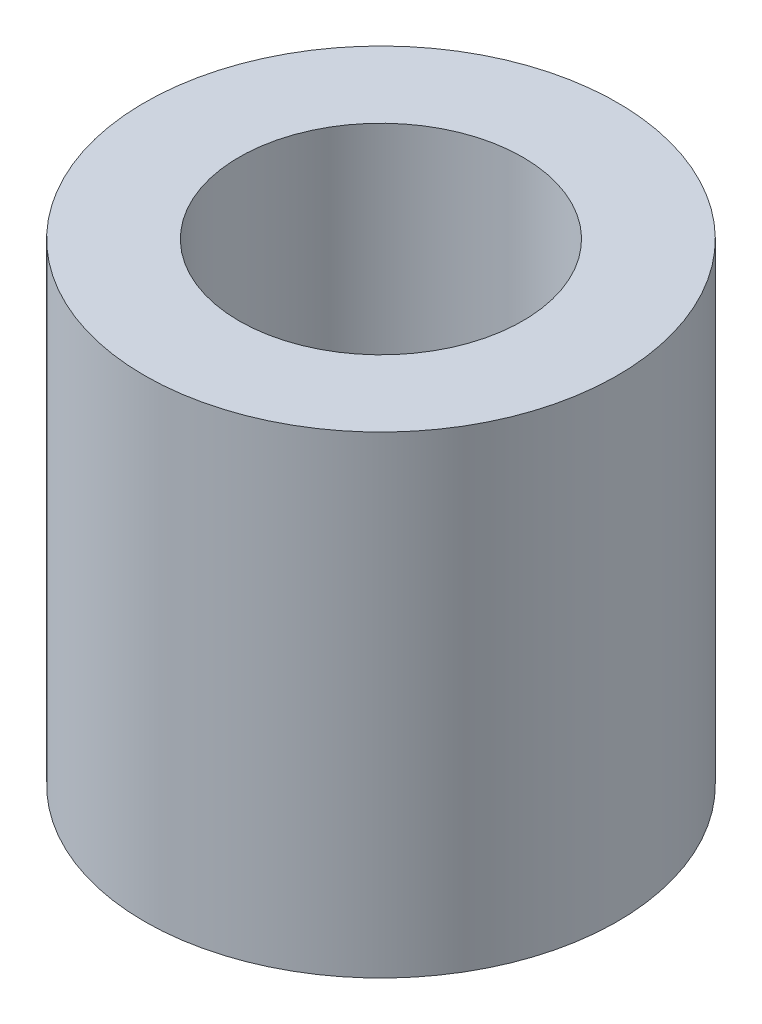
from build123d import *

# Parameters (mm, degrees)
SKETCH_1_R      = 5
SKETCH_1_R_2    = 3
EXTRUDE_1_DEPTH = 10


with BuildPart() as part:
    # 草图1 → 凸台-拉伸1 (new body)
    with BuildSketch(Plane(origin=(0, 0, 0), x_dir=(1, 0, 0), z_dir=(0, 1, 0))):
        with Locations(Location((0, 0, 0), (0, 0, 270))):
            Circle(SKETCH_1_R)
        with Locations(Location((0, 0, 0), (0, 0, 270))):
            Circle(SKETCH_1_R_2, mode=Mode.SUBTRACT)
    extrude(amount=EXTRUDE_1_DEPTH)


solid = part.part
